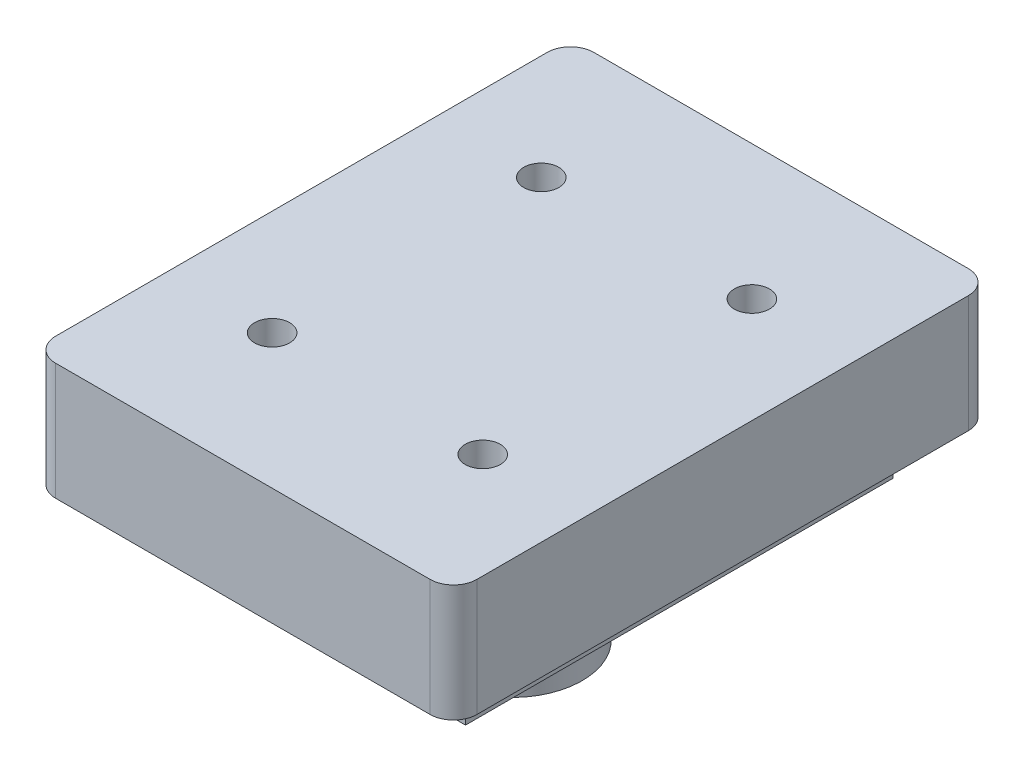
from build123d import *

# Parameters (mm, degrees)
SKETCH1_W           = 45.72
SKETCH1_H           = 58.42
BOSS_EXTRUDE1_DEPTH = 12.7
SKETCH2_R           = 1.905
CUT_EXTRUDE1_DEPTH  = 42.348948188
SKETCH3_W           = 36.327462092
SKETCH3_H           = 46.418423785
BOSS_EXTRUDE2_DEPTH = 5.08
SKETCH4_R           = 7.62
SKETCH4_R_2         = 5.08
BOSS_EXTRUDE3_DEPTH = 12.7
FILLET1_R           = 2.54


with BuildPart() as part:
    # Sketch1 → Boss-Extrude1 (new body)
    with BuildSketch(Plane(origin=(0, 0, 0), x_dir=(1, 0, 0), z_dir=(0, 1, 0))):
        with Locations((2.874210526, -0.559043062)):
            Rectangle(SKETCH1_W, SKETCH1_H)
    extrude(amount=BOSS_EXTRUDE1_DEPTH)

    # Sketch2 → Cut-Extrude1 (cut, through all)
    with BuildSketch(Plane(origin=(0, 12.7, 0), x_dir=(1, 0, 0), z_dir=(0, 1, 0))):
        with Locations(Location((-8.555789474, 14.045956938, 0), (0, 0, 270))):
            Circle(SKETCH2_R)
        with Locations(Location((14.304210526, 14.045956938, 0), (0, 0, 270))):
            Circle(SKETCH2_R)
        with Locations(Location((-8.555789474, -15.164043062, 0), (0, 0, 270))):
            Circle(SKETCH2_R)
        with Locations(Location((14.304210526, -15.164043062, 0), (0, 0, 270))):
            Circle(SKETCH2_R)
    extrude(amount=-CUT_EXTRUDE1_DEPTH, mode=Mode.SUBTRACT)

    # Sketch3 → Boss-Extrude2 (add)
    with BuildSketch(Plane.XZ):
        with Locations((2.874210526, 0.559043062)):
            Rectangle(SKETCH3_W, SKETCH3_H)
    extrude(amount=BOSS_EXTRUDE2_DEPTH)

    # Sketch4 → Boss-Extrude3 (add)
    with BuildSketch(Plane.XZ.offset(5.08)):
        with Locations(Location((2.874210526, 0.559043062, 0), (0, 0, 270))):
            Circle(SKETCH4_R)
        with Locations(Location((2.874210526, 0.559043062, 0), (0, 0, 270))):
            Circle(SKETCH4_R_2, mode=Mode.SUBTRACT)
    extrude(amount=BOSS_EXTRUDE3_DEPTH)

    # Fillet1
    fillet1_edges = [part.edges().sort_by_distance(p)[0] for p in [
        (-19.985789474, 6.35, -28.650956938),
        (25.734210526, 6.35, -28.650956938),
        (25.734210526, 6.35, 29.769043062),
        (-19.985789474, 6.35, 29.769043062),
    ]]
    fillet(fillet1_edges, radius=FILLET1_R)


solid = part.part
